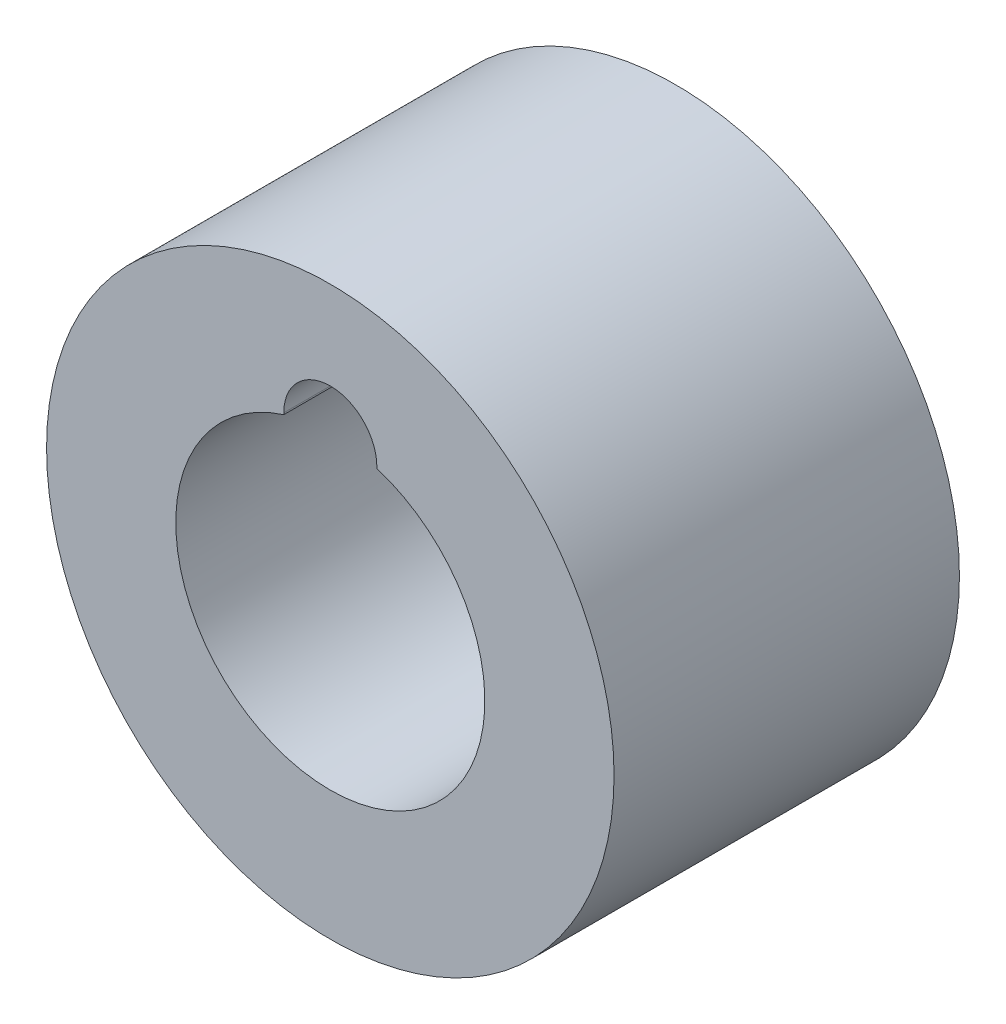
from build123d import *

# Parameters (mm, degrees)
CROQUIS1_R              = 7.62
CROQUIS1_R_2            = 4.15
SALIENTE_EXTRUIR1_DEPTH = 9.274999992
CORTAR_EXTRUIR1_DEPTH   = 15.218102013


with BuildPart() as part:
    # Croquis1 → Saliente-Extruir1 (new body)
    with BuildSketch(Plane.XY):
        Circle(CROQUIS1_R)
        Circle(CROQUIS1_R_2, mode=Mode.SUBTRACT)
    extrude(amount=SALIENTE_EXTRUIR1_DEPTH)

    # Croquis2 → Cortar-Extruir1 (cut, through all)
    with BuildSketch(Plane.XY.offset(9.274999992)):
        with BuildLine():
            Line((-1.25, 0), (-1.25, 4))
            ThreePointArc((-1.25, 4), (0, 5.25), (1.25, 4))
            Line((1.25, 4), (1.25, 0))
            ThreePointArc((1.25, 0), (0, -1.25), (-1.25, 0))
        make_face()
    extrude(amount=-CORTAR_EXTRUIR1_DEPTH, mode=Mode.SUBTRACT)


solid = part.part
